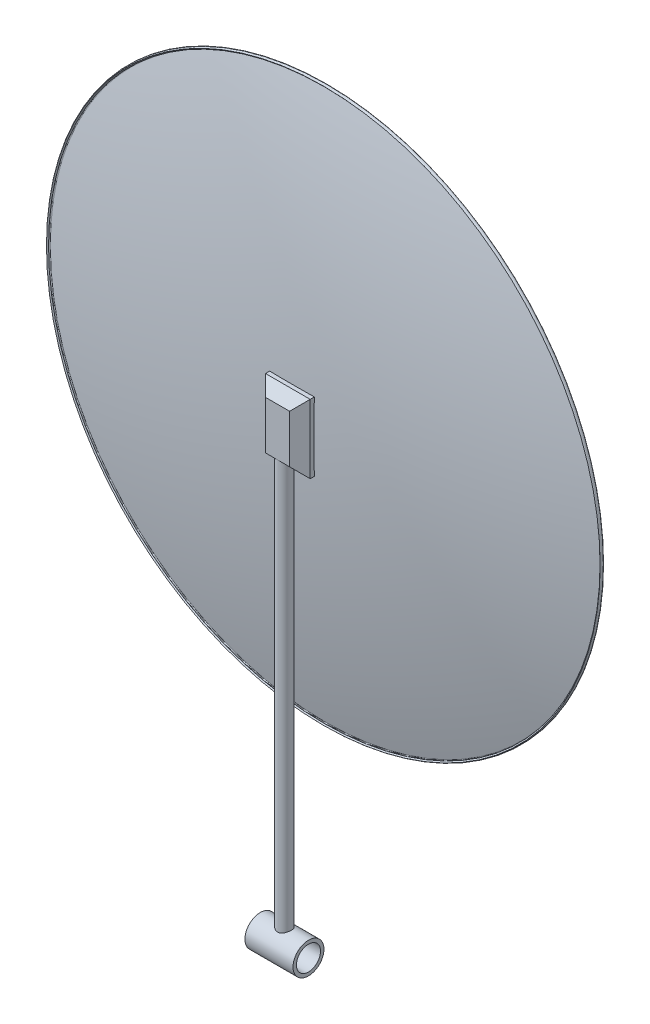
from build123d import *

# Parameters (mm, degrees)
IZIM1_W                                      = 65
IZIM1_H                                      = 100
Y_KSEKLIK_EKSTR_ZYON1_DEPTH                  = 20
Y_KSEKLIK_EKSTR_ZYON1_DIRECTION_2_REACH      = 575.479
Y_KSEKLIK_EKSTR_ZYON1_DIRECTION_2_END_RADIUS = 1627
PAH1_SIZE                                    = 15
IZIM4_R                                      = 22.5
IZIM4_R_2                                    = 17.5
Y_KSEKLIK_EKSTR_ZYON2_DEPTH                  = 35
S_P_R1_PROFILE_R                             = 10
Y_KSEKLIK_EKSTR_ZYON3_REACH                  = 1997.162
Y_KSEKLIK_EKSTR_ZYON3_END_RADIUS             = 22.5
IZIM14_R                                     = 10


with BuildPart() as part:
    # Sketch1 → Revolve1 (revolve)
    with BuildSketch(Plane(origin=(0, 0, 0), x_dir=(0, 0, -1), z_dir=(1, 0, 0)), mode=Mode.PRIVATE) as revolve1_sk:
        with BuildLine():
            Line((-1579.017970214, -401.050482857), (-1580.413520537, -402.642399801))
            ThreePointArc((-1580.413520537, -402.642399801), (-1576.632427652, -403.522199794), (-1575, -400))
            ThreePointArc((-1575, -400), (-1612.45154966, -201.556443707), (-1625, 0))
            Line((-1625, 0), (-1627, 0))
            ThreePointArc((-1627, 0), (-1614.436105413, -201.804513177), (-1576.938461538, -400.492307692))
            ThreePointArc((-1576.938461538, -400.492307692), (-1577.702877842, -401.79718049), (-1579.017970214, -401.050482857))
        make_face()
    revolve(revolve1_sk.sketch.rotate(Axis((0, 0, 1625), (0, 0, 1)), 270), axis=Axis((0, 0, 1625), (0, 0, 1)))

    # Çizim1 → Yükseklik-Ekstrüzyon1 (add)
    with BuildSketch(Plane.XY.offset(1627)):
        Rectangle(IZIM1_W, IZIM1_H)
    extrude(amount=Y_KSEKLIK_EKSTR_ZYON1_DEPTH)

    # Yükseklik-Ekstrüzyon1 direction 2: up to this sphere (the profile starts outside it)
    y_kseklik_ekstr_zyon1_direction_2_end = Location((0, 0, 0)) * Sphere(Y_KSEKLIK_EKSTR_ZYON1_DIRECTION_2_END_RADIUS, mode=Mode.PRIVATE)
    # Çizim1 → Yükseklik-Ekstrüzyon1 direction 2 (add, up to the surface)
    with BuildSketch(Plane.XY.offset(1627), mode=Mode.PRIVATE) as y_kseklik_ekstr_zyon1_direction_2_sk1:
        Rectangle(IZIM1_W, IZIM1_H)
    y_kseklik_ekstr_zyon1_direction_2_tool1 = extrude(y_kseklik_ekstr_zyon1_direction_2_sk1.sketch, amount=-Y_KSEKLIK_EKSTR_ZYON1_DIRECTION_2_REACH, mode=Mode.PRIVATE) - y_kseklik_ekstr_zyon1_direction_2_end
    add(y_kseklik_ekstr_zyon1_direction_2_tool1.solids().sort_by_distance((0, 0, 1627))[0])

    # Pah1
    pah1_edges = [part.edges().sort_by_distance(p)[0] for p in [
        (32.5, 0, 1647),
        (0, 50, 1647),
        (-32.5, 0, 1647),
        (0, -50, 1647),
    ]]
    chamfer(pah1_edges, length=PAH1_SIZE)

    # Süpür1: sweep along a path in Çizim5
    with BuildLine(Plane(origin=(0, 0, 0), x_dir=(0, 0, -1), z_dir=(1, 0, 0))) as s_p_r1_path:
        Line((-1637, -627.5), (-1637, 0.081222763))
    # Süpür1 profile (on start of the path) → Süpür1 (sweep)
    with BuildSketch(Plane(origin=(0, -627.5, 1637), x_dir=(0, 0, 1), z_dir=(0, 1, 0))):
        Circle(S_P_R1_PROFILE_R)
    sweep(path=s_p_r1_path.line)



with BuildPart() as body_2:
    # Çizim4 → Yükseklik-Ekstrüzyon2 (new, symmetric)
    with BuildSketch(Plane(origin=(0, 0, 0), x_dir=(0, 0, -1), z_dir=(1, 0, 0))):
        with Locations((-1637, -650)):
            Circle(IZIM4_R)
        with Locations((-1637, -650)):
            Circle(IZIM4_R_2, mode=Mode.SUBTRACT)
    extrude(amount=Y_KSEKLIK_EKSTR_ZYON2_DEPTH, both=True)


with BuildPart() as part_1:
    add(part.part)

    add(body_2.part)  # Yükseklik-Ekstrüzyon3 merges body 2
    # Yükseklik-Ekstrüzyon3: up to this cylinder (the profile starts outside it)
    y_kseklik_ekstr_zyon3_end = Plane(origin=(0, -650, 1637), z_dir=(-1, 0, 0)) * Cylinder(Y_KSEKLIK_EKSTR_ZYON3_END_RADIUS, 4040.324, mode=Mode.PRIVATE)
    # Çizim14 → Yükseklik-Ekstrüzyon3 (add, up to the surface)
    with BuildSketch(Plane.XZ.offset(627.5), mode=Mode.PRIVATE) as y_kseklik_ekstr_zyon3_sk1:
        with Locations(Location((0, 1637, 0), (0, 0, 90))):
            Circle(IZIM14_R)
    y_kseklik_ekstr_zyon3_tool1 = extrude(y_kseklik_ekstr_zyon3_sk1.sketch, amount=Y_KSEKLIK_EKSTR_ZYON3_REACH, mode=Mode.PRIVATE) - y_kseklik_ekstr_zyon3_end
    add(y_kseklik_ekstr_zyon3_tool1.solids().sort_by_distance((0, -627.5, 1637))[0])
    add(y_kseklik_ekstr_zyon3_tool1.solids().sort_by_distance((0, -627.5, 1637))[1])


solid = part_1.part
